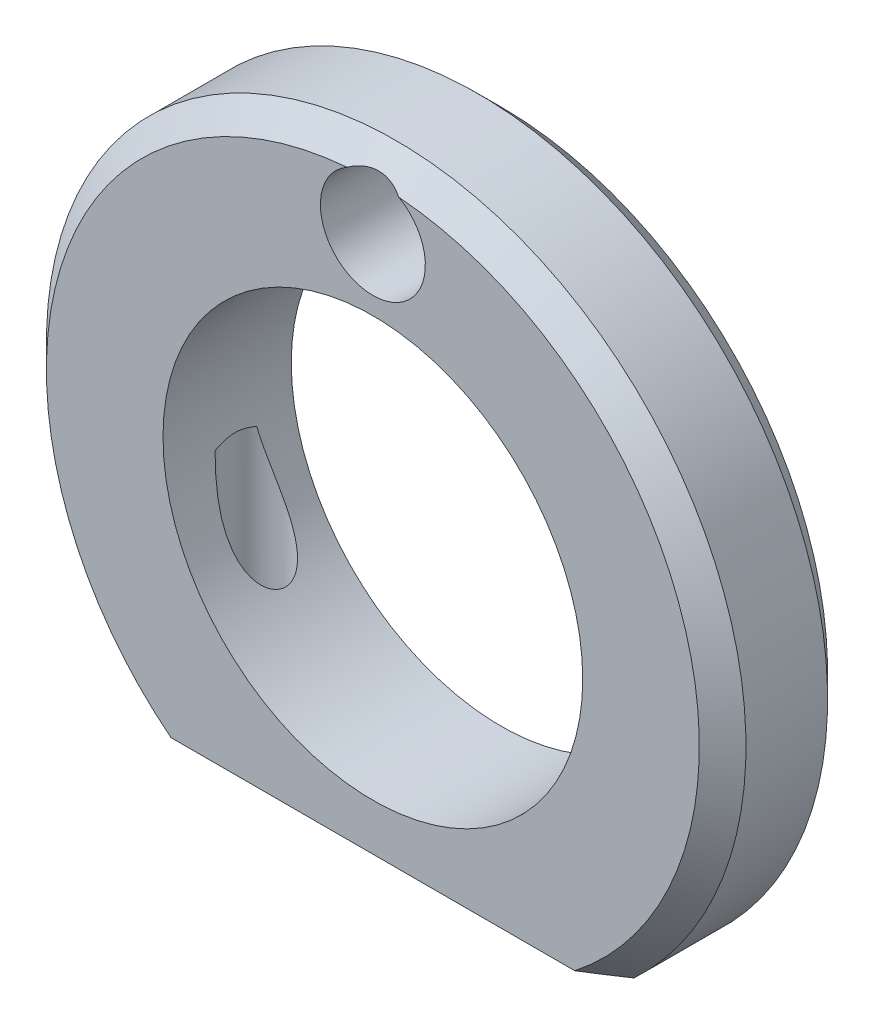
from build123d import *

# Parameters (mm, degrees)
SKETCH_1_R             = 7
SKETCH_1_R_2           = 5.5
EXTRUDE_1_DEPTH        = 30
EXTRUDE_START          = -7
SKETCH_2_R             = 15
SKETCH_2_R_2           = 5.5
EXTRUDE_2_DEPTH        = 7
SKETCH_5_W             = 5.5
SKETCH_5_H             = 9
CUT_EXTRUDE_4_DEPTH    = 15
HOLE_WIZARD_M3_1_D     = 2.5
HOLE_WIZARD_M3_1_DEPTH = 9.5
HOLE_WIZARD_M3_1_TIP   = 0.751075774
FILLET_1_R             = 1
SKETCH1_R              = 7.5
EXTRUDE1_DEPTH         = 5
CHAMFER1_SIZE          = 1
SKETCH_9_R             = 18
CUT_EXTRUDE_1_DEPTH    = 55
SKETCH_10_R            = 9
CUT_EXTRUDE_2_DEPTH    = 22.914607001
CHAMFER_5_SIZE         = 1
SKETCH_11_R            = 2.25
CUT_EXTRUDE_3_DEPTH    = 5.5


with BuildPart() as part:
    # 草图1 → 拉伸1 (new, symmetric)
    with BuildSketch(Plane.XY):
        Circle(SKETCH_1_R)
        Circle(SKETCH_1_R_2, mode=Mode.SUBTRACT)
    extrude(amount=EXTRUDE_1_DEPTH, both=True)

    # 草图2 → 拉伸2 (add)
    with BuildSketch(Plane.XY.offset(30).offset(EXTRUDE_START)):
        Circle(SKETCH_2_R)
        Circle(SKETCH_2_R_2, mode=Mode.SUBTRACT)
    extrude_2 = extrude(amount=EXTRUDE_2_DEPTH)

    # 镜向1: 拉伸2 across plane
    add(extrude_2.mirror(Plane.XY))

    # 草图5 → 拉伸4 (cut, symmetric)
    with BuildSketch(Plane(origin=(0, 0, 0), x_dir=(0, 0, -1), z_dir=(1, 0, 0))):
        with Locations((-27.25, -15.5)):
            Rectangle(SKETCH_5_W, SKETCH_5_H)
        with Locations((27.25, -15.5)):
            Rectangle(SKETCH_5_W, SKETCH_5_H)
    extrude(amount=CUT_EXTRUDE_4_DEPTH, both=True, mode=Mode.SUBTRACT)

    # M3 螺纹孔1
    with Locations(Plane(origin=(-8, -11, 27.5), x_dir=(0, 0, -1), z_dir=(0, -1, 0))):
        with Locations((0, 0), (0, 16), (55, 0), (55, 16)):
            Hole(HOLE_WIZARD_M3_1_D / 2, depth=HOLE_WIZARD_M3_1_DEPTH)
            with Locations((0, 0, -(HOLE_WIZARD_M3_1_DEPTH + HOLE_WIZARD_M3_1_TIP / 2))):  # 118° drill point
                Cone(0, HOLE_WIZARD_M3_1_D / 2, HOLE_WIZARD_M3_1_TIP, mode=Mode.SUBTRACT)

    # 圆角1
    fillet_1_edges = [part.edges().sort_by_distance(p)[0] for p in [
        (-7, 0, -23),
        (-7, 0, 23),
    ]]
    fillet(fillet_1_edges, radius=FILLET_1_R)

    # Sketch1 → Extrude1 (cut)
    with BuildSketch(Plane(origin=(0, 0, 30), x_dir=(-1, 0, 0), z_dir=(0, 0, -1))):
        Circle(SKETCH1_R)
    extrude(amount=EXTRUDE1_DEPTH, mode=Mode.SUBTRACT)

    # Chamfer1
    chamfer1_edges = [part.edges().sort_by_distance(p)[0] for p in [
        (-5.5, 0, 25),
    ]]
    chamfer(chamfer1_edges, length=CHAMFER1_SIZE)

    # 草图9 → 切除-拉伸1 (cut)
    with BuildSketch(Plane(origin=(0, 0, -24.5), x_dir=(-1, 0, 0), z_dir=(0, 0, -1))):
        Circle(SKETCH_9_R)
    extrude(amount=-CUT_EXTRUDE_1_DEPTH, mode=Mode.SUBTRACT)

    # 草图10 → 切除-拉伸2 (cut, through all)
    with BuildSketch(Plane(origin=(0, 0, -30), x_dir=(-1, 0, 0), z_dir=(0, 0, -1))):
        Circle(SKETCH_10_R)
    extrude(amount=-CUT_EXTRUDE_2_DEPTH, mode=Mode.SUBTRACT)

    # 倒角5
    chamfer_5_edges = [part.edges().sort_by_distance(p)[0] for p in [
        (0, 15, -30),
        (0, 15, -24.5),
    ]]
    chamfer(chamfer_5_edges, length=CHAMFER_5_SIZE)

    # 草图11 → 切除-拉伸3 (cut)
    with BuildSketch(Plane.XY.offset(-24.5)):
        with Locations(Location((0, 12, 0), (0, 0, 60.367309199))):
            Circle(SKETCH_11_R)
    extrude(amount=-CUT_EXTRUDE_3_DEPTH, mode=Mode.SUBTRACT)


solid = part.part
